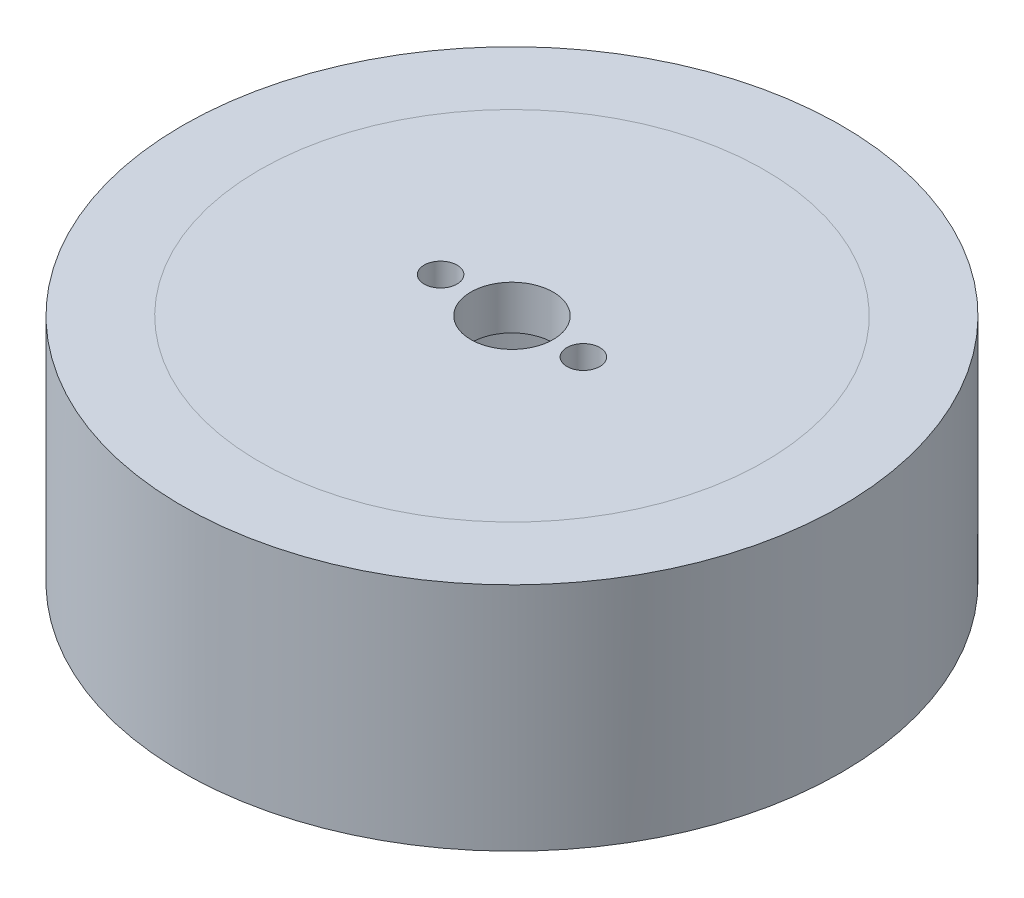
from build123d import *

# Parameters (mm, degrees)
CUT_EXTRUDE_1_DEPTH      = 39.716921365
CUT_EXTRUDE_1_DEPTH_BACK = 39.716921365
SKETCH_2_R               = 3.75
SKETCH_2_R_2             = 1.5
SKETCH_3_R               = 30
SKETCH_3_R_2             = 23
EXTRUDE_1_DEPTH          = 21


with BuildPart() as part:
    # 草图1 → 旋转1 (revolve)
    with BuildSketch(Plane.XY):
        Polygon((0, 0), (0, -4), (-21, -4), (-21, -21), (-23, -21), (-23, 0), align=None)
    revolve(axis=Axis((0, 0, 0), (0, -1, 0)))

    # 草图2 → 切除-拉伸1 (cut, two sides: drawn at the far end of the back side and taken through both)
    with BuildSketch(Plane(origin=(0, 0, 0), x_dir=(1, 0, 0), z_dir=(0, 1, 0)).offset(-CUT_EXTRUDE_1_DEPTH_BACK)):
        with Locations(Location((0, 0, 0), (0, 0, 270))):
            Circle(SKETCH_2_R)
        with Locations(Location((-6.5, 0, 0), (0, 0, 270))):
            Circle(SKETCH_2_R_2)
        with Locations(Location((6.5, 0, 0), (0, 0, 270))):
            Circle(SKETCH_2_R_2)
    extrude(amount=CUT_EXTRUDE_1_DEPTH + CUT_EXTRUDE_1_DEPTH_BACK, mode=Mode.SUBTRACT)


with BuildPart() as body_2:
    # 草图3 → 凸台-拉伸1 (new body)
    with BuildSketch(Plane(origin=(0, 0, 0), x_dir=(1, 0, 0), z_dir=(0, 1, 0))):
        with Locations(Location((0, 0, 0), (0, 0, 180))):
            Circle(SKETCH_3_R)
        with Locations(Location((0, 0, 0), (0, 0, 180))):
            Circle(SKETCH_3_R_2, mode=Mode.SUBTRACT)
    extrude(amount=-EXTRUDE_1_DEPTH)


solid = Compound([part.part, body_2.part])
